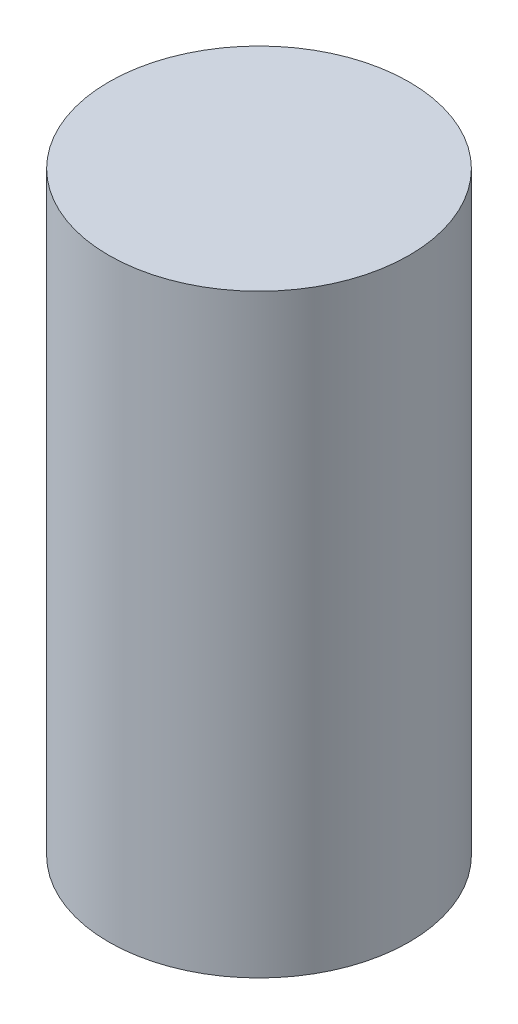
from build123d import *

# Parameters (mm, degrees)
SKETCH2_R           = 5
SKETCH2_R_2         = 2.75
BOSS_EXTRUDE1_DEPTH = 3.8
SKETCH5_R           = 5
BOSS_EXTRUDE2_DEPTH = 16


with BuildPart() as part:
    # Sketch2 → Boss-Extrude1 (new body)
    with BuildSketch(Plane(origin=(0, 0, 0), x_dir=(1, 0, 0), z_dir=(0, 1, 0))):
        with Locations(Location((0, 0, 0), (0, 0, 90))):
            Circle(SKETCH2_R)
        with Locations(Location((0, 0, 0), (0, 0, 90))):
            Circle(SKETCH2_R_2, mode=Mode.SUBTRACT)
    extrude(amount=BOSS_EXTRUDE1_DEPTH)

    # Sketch5 → Boss-Extrude2 (add)
    with BuildSketch(Plane(origin=(0, 3.8, 0), x_dir=(1, 0, 0), z_dir=(0, 1, 0))):
        with Locations(Location((0, 0, 0), (0, 0, 90))):
            Circle(SKETCH5_R)
    extrude(amount=BOSS_EXTRUDE2_DEPTH)


solid = part.part
